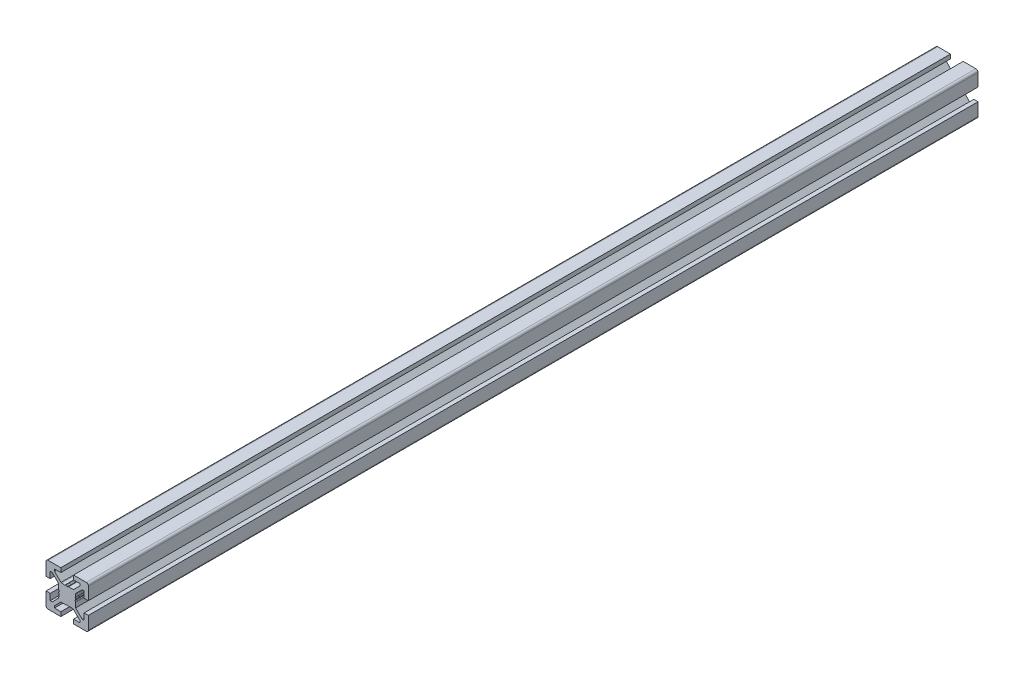
from build123d import *

# Parameters (mm, degrees)
SKETCH1_R           = 2.1
BOSS_EXTRUDE1_DEPTH = 400
EXTRUDE_1_DEPTH     = 20


with BuildPart() as part:
    # Sketch1 → Boss-Extrude1 (new body)
    with BuildSketch(Plane(origin=(0, 0, -2000), x_dir=(-1, 0, 0), z_dir=(0, 0, -1))):
        with BuildLine():
            Line((10, -3), (8, -3))
            Line((8, -3), (8, -6))
            Line((8, -6), (7.060660172, -6))
            Line((7.060660172, -6), (4, -2.939339828))
            Line((4, -2.939339828), (4, -2.5))
            Line((4, -2.5), (3.750976592, -1.218885629))
            Line((3.750976592, -1.218885629), (3.933012702, -0.903589838))
            ThreePointArc((3.933012702, -0.903589838), (4, -0.653589838), (3.933012702, -0.403589838))
            Line((3.933012702, -0.403589838), (3.7, 0))
            Line((3.7, 0), (3.933012702, 0.403589838))
            ThreePointArc((3.933012702, 0.403589838), (3.982962913, 0.524180316), (4, 0.653589838))
            Line((4, 0.653589838), (4, 2.939339828))
            Line((4, 2.939339828), (7.060660172, 6))
            Line((7.060660172, 6), (8, 6))
            Line((8, 6), (8, 3))
            Line((8, 3), (10, 3))
            Line((10, 3), (10, 9))
            ThreePointArc((10, 9), (9.707106781, 9.707106781), (9, 10))
            Line((9, 10), (3, 10))
            Line((3, 10), (3, 8))
            Line((3, 8), (6, 8))
            Line((6, 8), (6, 7.060660172))
            Line((6, 7.060660172), (2.939339828, 4))
            Line((2.939339828, 4), (2.5, 4))
            Line((2.5, 4), (1.218885629, 3.750976592))
            Line((1.218885629, 3.750976592), (0.903589838, 3.933012702))
            ThreePointArc((0.903589838, 3.933012702), (0.653589838, 4), (0.403589838, 3.933012702))
            Line((0.403589838, 3.933012702), (0, 3.7))
            Line((0, 3.7), (-0.403589838, 3.933012702))
            ThreePointArc((-0.403589838, 3.933012702), (-0.524180316, 3.982962913), (-0.653589838, 4))
            Line((-0.653589838, 4), (-2.939339828, 4))
            Line((-2.939339828, 4), (-6, 7.060660172))
            Line((-6, 7.060660172), (-6, 8))
            Line((-6, 8), (-3, 8))
            Line((-3, 8), (-3, 10))
            Line((-3, 10), (-9, 10))
            ThreePointArc((-9, 10), (-9.707106781, 9.707106781), (-10, 9))
            Line((-10, 9), (-10, 3))
            Line((-10, 3), (-8, 3))
            Line((-8, 3), (-8, 6))
            Line((-8, 6), (-7.060660172, 6))
            Line((-7.060660172, 6), (-4, 2.939339828))
            Line((-4, 2.939339828), (-4, 2.5))
            Line((-4, 2.5), (-3.750976592, 1.218885629))
            Line((-3.750976592, 1.218885629), (-3.933012702, 0.903589838))
            ThreePointArc((-3.933012702, 0.903589838), (-4, 0.653589838), (-3.933012702, 0.403589838))
            Line((-3.933012702, 0.403589838), (-3.7, 0))
            Line((-3.7, 0), (-3.933012702, -0.403589838))
            ThreePointArc((-3.933012702, -0.403589838), (-3.982962913, -0.524180316), (-4, -0.653589838))
            Line((-4, -0.653589838), (-4, -2.939339828))
            Line((-4, -2.939339828), (-7.060660172, -6))
            Line((-7.060660172, -6), (-8, -6))
            Line((-8, -6), (-8, -3))
            Line((-8, -3), (-10, -3))
            Line((-10, -3), (-10, -9))
            ThreePointArc((-10, -9), (-9.707106781, -9.707106781), (-9, -10))
            Line((-9, -10), (-3, -10))
            Line((-3, -10), (-3, -8))
            Line((-3, -8), (-6, -8))
            Line((-6, -8), (-6, -7.060660172))
            Line((-6, -7.060660172), (-2.939339828, -4))
            Line((-2.939339828, -4), (-2.5, -4))
            Line((-2.5, -4), (-1.218885629, -3.750976592))
            Line((-1.218885629, -3.750976592), (-0.903589838, -3.933012702))
            ThreePointArc((-0.903589838, -3.933012702), (-0.653589838, -4), (-0.403589838, -3.933012702))
            Line((-0.403589838, -3.933012702), (0, -3.7))
            Line((0, -3.7), (0.403589838, -3.933012702))
            ThreePointArc((0.403589838, -3.933012702), (0.524180316, -3.982962913), (0.653589838, -4))
            Line((0.653589838, -4), (2.939339828, -4))
            Line((2.939339828, -4), (6, -7.060660172))
            Line((6, -7.060660172), (6, -8))
            Line((6, -8), (3, -8))
            Line((3, -8), (3, -10))
            Line((3, -10), (9, -10))
            ThreePointArc((9, -10), (9.707106781, -9.707106781), (10, -9))
            Line((10, -9), (10, -3))
        make_face()
        with Locations(Location((0, 0, 0), (0, 0, 180))):
            Circle(SKETCH1_R, mode=Mode.SUBTRACT)
    extrude(amount=-BOSS_EXTRUDE1_DEPTH)

    # 草图1 → 凸台-拉伸1 (add)
    with BuildSketch(Plane.XY.offset(-1600)):
        with BuildLine():
            Line((-10, -3), (-10, -9))
            ThreePointArc((-10, -9), (-9.707106781, -9.707106781), (-9, -10))
            Line((-9, -10), (-3, -10))
            Line((-3, -10), (-3, -8))
            Line((-3, -8), (-6, -8))
            Line((-6, -8), (-6, -7.060660172))
            Line((-6, -7.060660172), (-2.939339828, -4))
            Line((-2.939339828, -4), (-0.653589838, -4))
            ThreePointArc((-0.653589838, -4), (-0.524180316, -3.982962913), (-0.403589838, -3.933012702))
            Line((-0.403589838, -3.933012702), (0, -3.7))
            Line((0, -3.7), (0.403589838, -3.933012702))
            ThreePointArc((0.403589838, -3.933012702), (0.653589838, -4), (0.903589838, -3.933012702))
            Line((0.903589838, -3.933012702), (1.218885629, -3.750976592))
            Line((1.218885629, -3.750976592), (2.5, -4))
            Line((2.5, -4), (2.939339828, -4))
            Line((2.939339828, -4), (6, -7.060660172))
            Line((6, -7.060660172), (6, -8))
            Line((6, -8), (3, -8))
            Line((3, -8), (3, -10))
            Line((3, -10), (9, -10))
            ThreePointArc((9, -10), (9.707106781, -9.707106781), (10, -9))
            Line((10, -9), (10, -3))
            Line((10, -3), (8, -3))
            Line((8, -3), (8, -6))
            Line((8, -6), (7.060660172, -6))
            Line((7.060660172, -6), (4, -2.939339828))
            Line((4, -2.939339828), (4, -0.653589838))
            ThreePointArc((4, -0.653589838), (3.982962913, -0.524180316), (3.933012702, -0.403589838))
            Line((3.933012702, -0.403589838), (3.7, 0))
            Line((3.7, 0), (3.933012702, 0.403589838))
            ThreePointArc((3.933012702, 0.403589838), (4, 0.653589838), (3.933012702, 0.903589838))
            Line((3.933012702, 0.903589838), (3.750976592, 1.218885629))
            Line((3.750976592, 1.218885629), (4, 2.5))
            Line((4, 2.5), (4, 2.939339828))
            Line((4, 2.939339828), (7.060660172, 6))
            Line((7.060660172, 6), (8, 6))
            Line((8, 6), (8, 3))
            Line((8, 3), (10, 3))
            Line((10, 3), (10, 9))
            ThreePointArc((10, 9), (9.707106781, 9.707106781), (9, 10))
            Line((9, 10), (3, 10))
            Line((3, 10), (3, 8))
            Line((3, 8), (6, 8))
            Line((6, 8), (6, 7.060660172))
            Line((6, 7.060660172), (2.939339828, 4))
            Line((2.939339828, 4), (0.653589838, 4))
            ThreePointArc((0.653589838, 4), (0.524180316, 3.982962913), (0.403589838, 3.933012702))
            Line((0.403589838, 3.933012702), (0, 3.7))
            Line((0, 3.7), (-0.403589838, 3.933012702))
            ThreePointArc((-0.403589838, 3.933012702), (-0.653589838, 4), (-0.903589838, 3.933012702))
            Line((-0.903589838, 3.933012702), (-1.218885629, 3.750976592))
            Line((-1.218885629, 3.750976592), (-2.5, 4))
            Line((-2.5, 4), (-2.939339828, 4))
            Line((-2.939339828, 4), (-6, 7.060660172))
            Line((-6, 7.060660172), (-6, 8))
            Line((-6, 8), (-3, 8))
            Line((-3, 8), (-3, 10))
            Line((-3, 10), (-9, 10))
            ThreePointArc((-9, 10), (-9.707106781, 9.707106781), (-10, 9))
            Line((-10, 9), (-10, 3))
            Line((-10, 3), (-8, 3))
            Line((-8, 3), (-8, 6))
            Line((-8, 6), (-7.060660172, 6))
            Line((-7.060660172, 6), (-4, 2.939339828))
            Line((-4, 2.939339828), (-4, 0.653589838))
            ThreePointArc((-4, 0.653589838), (-3.982962913, 0.524180316), (-3.933012702, 0.403589838))
            Line((-3.933012702, 0.403589838), (-3.7, 0))
            Line((-3.7, 0), (-3.933012702, -0.403589838))
            ThreePointArc((-3.933012702, -0.403589838), (-4, -0.653589838), (-3.933012702, -0.903589838))
            Line((-3.933012702, -0.903589838), (-3.750976592, -1.218885629))
            Line((-3.750976592, -1.218885629), (-4, -2.5))
            Line((-4, -2.5), (-4, -2.939339828))
            Line((-4, -2.939339828), (-7.060660172, -6))
            Line((-7.060660172, -6), (-8, -6))
            Line((-8, -6), (-8, -3))
            Line((-8, -3), (-10, -3))
        make_face()
    extrude(amount=EXTRUDE_1_DEPTH)


solid = part.part
